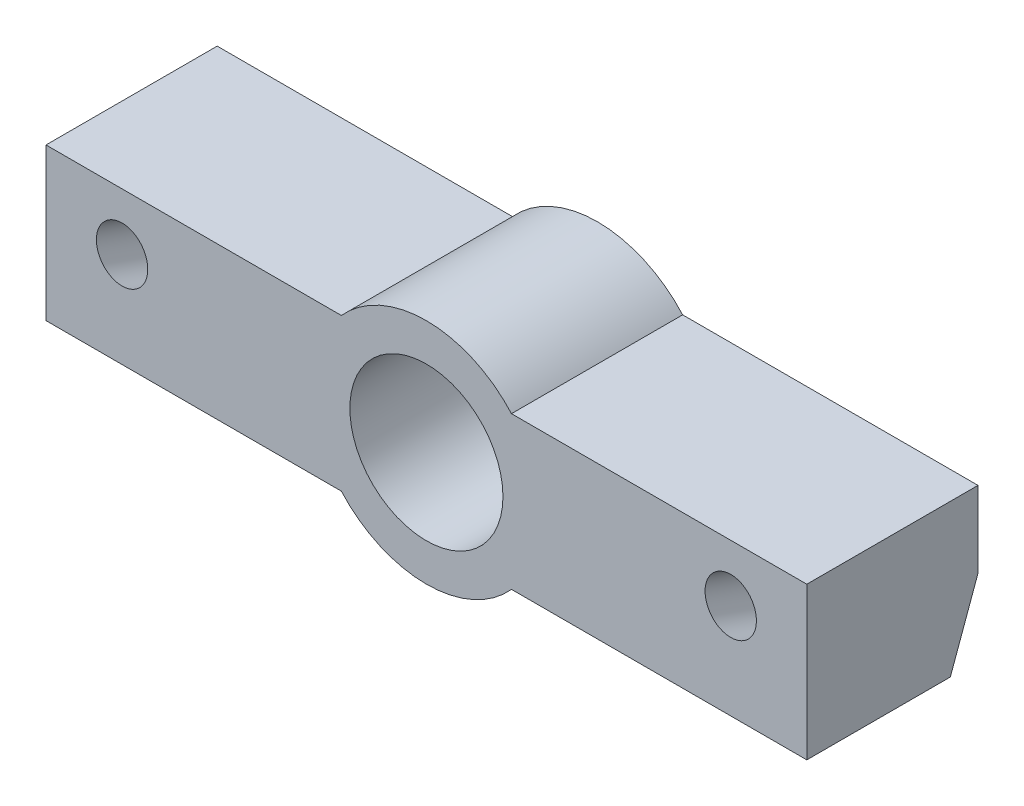
from build123d import *

# Parameters (mm, degrees)
BOSS_EXTRUDE1_DEPTH        = 9
SKETCH11_R                 = 4.025
CUT_EXTRUDE4_DEPTH         = 7
CUT_EXTRUDE2_DEPTH         = 42.43669871
F_2_7_2_7_DIAMETER_HOLE1_D = 2.7


with BuildPart() as part:
    # Sketch1 → Boss-Extrude1 (new body)
    with BuildSketch(Plane.XY):
        with BuildLine():
            Line((-4.472135955, 4), (-20, 4))
            Line((-20, 4), (-20, -4))
            Line((-20, -4), (-4.472135955, -4))
            ThreePointArc((-4.472135955, -4), (0, -6), (4.472135955, -4))
            Line((4.472135955, -4), (20, -4))
            Line((20, -4), (20, 4))
            Line((20, 4), (4.472135955, 4))
            ThreePointArc((4.472135955, 4), (0, 6), (-4.472135955, 4))
        make_face()
    extrude(amount=BOSS_EXTRUDE1_DEPTH)

    # Sketch11 → Cut-Extrude4 (cut)
    with BuildSketch(Plane.XY.offset(9)):
        Circle(SKETCH11_R)
    extrude(amount=-CUT_EXTRUDE4_DEPTH, mode=Mode.SUBTRACT)

    # Sketch5 → Cut-Extrude2 (cut, through all)
    with BuildSketch(Plane.ZY.offset(20)):
        Polygon((0, 0), (2.183821406, -6), (0, -6), align=None)
    extrude(amount=-CUT_EXTRUDE2_DEPTH, mode=Mode.SUBTRACT)

    # Ø2.7 (2.7) Diameter Hole1 (through all)
    with Locations(Plane(origin=(0, 0, 0), x_dir=(-1, 0, 0), z_dir=(0, -0.34202014332566316, -0.9396926207859104))):
        with Locations((-16, -2.128355545), (16, -2.128355545)):
            Hole(F_2_7_2_7_DIAMETER_HOLE1_D / 2)


solid = part.part
